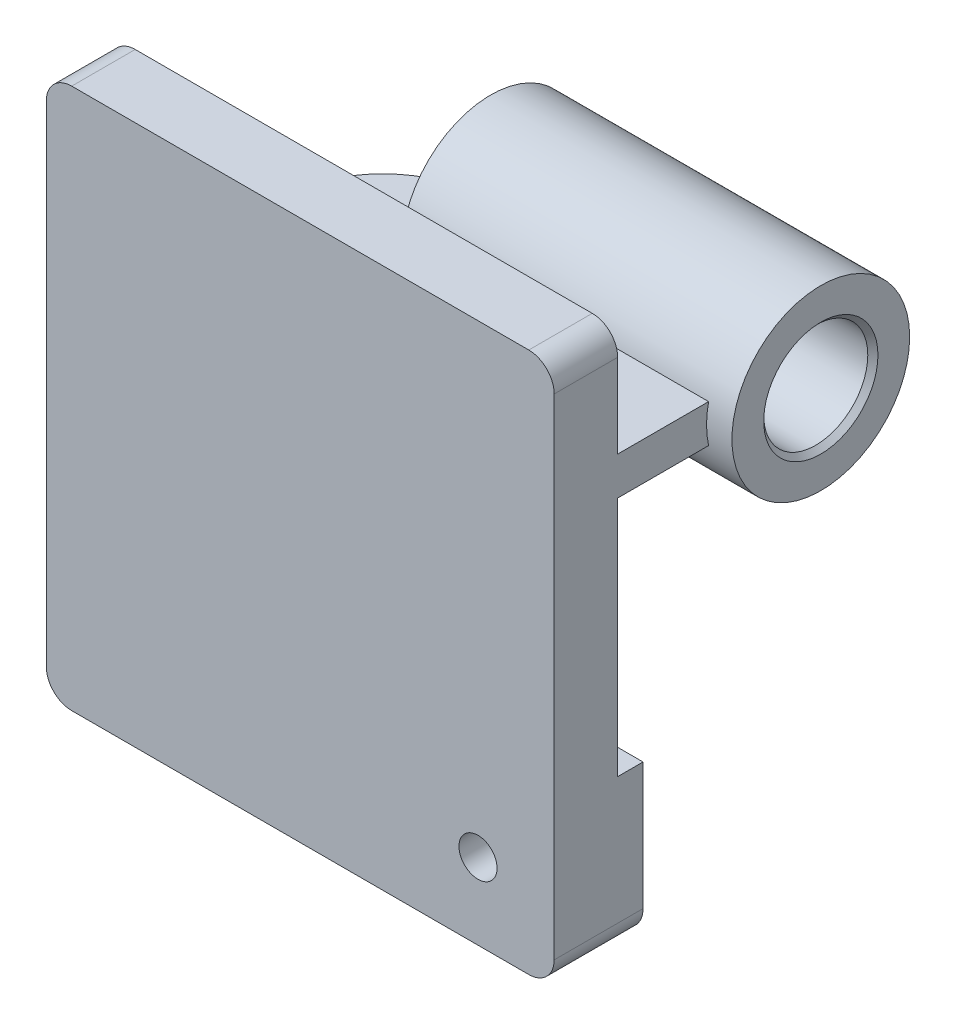
from build123d import *

# Parameters (mm, degrees)
SKETCH1_W                               = 200
SKETCH1_H                               = 213
BOSS_EXTRUDE1_DEPTH                     = 25
BOSS_EXTRUDE2_DEPTH                     = 10
BOSS_EXTRUDE3_DEPTH                     = 70
CUT_EXTRUDE1_DEPTH                      = 20
BOSS_EXTRUDE5_DEPTH                     = 10
BOSS_EXTRUDE5_DEPTH_BACK                = 120
SKETCH5_R                               = 35
BOSS_EXTRUDE6_DEPTH                     = 10
BOSS_EXTRUDE6_DEPTH_BACK                = 120
SKETCH6_R                               = 41.5
CUT_EXTRUDE2_REACH                      = 274.509
SKETCH7_R                               = 20.5
CUT_EXTRUDE3_REACH                      = 209.134
SKETCH8_R                               = 20.5
CBORE_FOR_M8_HEX_HEAD_BOLT1_D           = 15
CBORE_FOR_M8_HEX_HEAD_BOLT1_CBORE_D     = 30
CBORE_FOR_M8_HEX_HEAD_BOLT1_CBORE_DEPTH = 10
CHAMFER1_SIZE                           = 2
FILLET1_R                               = 10


with BuildPart() as part:
    # Sketch1 → Boss-Extrude1 (new body)
    with BuildSketch(Plane.XY):
        Rectangle(SKETCH1_W, SKETCH1_H)
    extrude(amount=BOSS_EXTRUDE1_DEPTH)

    # Sketch2 → Boss-Extrude2 (add)
    with BuildSketch(Plane.XY):
        with BuildLine():
            Line((100, -46.5), (55, -46.5))
            ThreePointArc((55, -46.5), (44.393398282, -50.893398282), (40, -61.5))
            Line((40, -61.5), (40, -106.5))
            Line((40, -106.5), (100, -106.5))
            Line((100, -106.5), (100, -46.5))
        make_face()
    extrude(amount=-BOSS_EXTRUDE2_DEPTH)

    # Sketch3 → Boss-Extrude3 (add)
    with BuildSketch(Plane(origin=(0, 0, 0), x_dir=(-1, 0, 0), z_dir=(0, 0, -1))):
        with BuildLine():
            Line((-100, 63.5), (-20, 63.5))
            ThreePointArc((-20, 63.5), (6.360389693, -0.139610307), (70, -26.5))
            Line((70, -26.5), (70, -106.5))
            Line((70, -106.5), (55, -106.5))
            Line((55, -106.5), (55, -41.5))
            ThreePointArc((55, -41.5), (-4.246212025, -10.746212025), (-35, 48.5))
            Line((-35, 48.5), (-100, 48.5))
            Line((-100, 48.5), (-100, 63.5))
        make_face()
    extrude(amount=BOSS_EXTRUDE3_DEPTH)

    # Sketch4 → Cut-Extrude1 (cut)
    with BuildSketch(Plane(origin=(0, 0, 0), x_dir=(-1, 0, 0), z_dir=(0, 0, -1))):
        with BuildLine():
            Line((-42.323661941, 39.5), (-91, 39.5))
            Line((-91, 39.5), (-91, -37.5))
            Line((-91, -37.5), (-55, -37.5))
            ThreePointArc((-55, -37.5), (-38.029437252, -44.529437252), (-31, -61.5))
            Line((-31, -61.5), (-31, -97.5))
            Line((-31, -97.5), (46, -97.5))
            Line((46, -97.5), (46, -48.823661941))
            ThreePointArc((46, -48.823661941), (-10.610173055, -17.110173055), (-42.323661941, 39.5))
        make_face()
    extrude(amount=-CUT_EXTRUDE1_DEPTH, mode=Mode.SUBTRACT)

    # Sketch5 → Boss-Extrude5 (add, two sides: drawn at the far end of the back side and taken through both)
    with BuildSketch(Plane(origin=(100, 0, 0), x_dir=(0, 0, -1), z_dir=(1, 0, 0)).offset(-BOSS_EXTRUDE5_DEPTH_BACK)):
        with Locations((70, 56)):
            Circle(SKETCH5_R)
    extrude(amount=BOSS_EXTRUDE5_DEPTH + BOSS_EXTRUDE5_DEPTH_BACK)

    # Sketch6 → Boss-Extrude6 (add, two sides: drawn at the far end of the back side and taken through both)
    with BuildSketch(Plane.XZ.offset(106.5).offset(-BOSS_EXTRUDE6_DEPTH_BACK)):
        with Locations(Location((-62.5, -70, 0), (0, 0, 270))):
            Circle(SKETCH6_R)
    extrude(amount=BOSS_EXTRUDE6_DEPTH + BOSS_EXTRUDE6_DEPTH_BACK)

    # Sketch7 → Cut-Extrude2 (cut, up to next)
    with BuildSketch(Plane.XZ.offset(116.5), mode=Mode.PRIVATE) as cut_extrude2_sk1:
        with Locations(Location((-62.5, -70, 0), (0, 0, 270))):
            Circle(SKETCH7_R)
    cut_extrude2_tool1 = extrude(cut_extrude2_sk1.sketch, amount=-CUT_EXTRUDE2_REACH, mode=Mode.PRIVATE) & part.part
    add(cut_extrude2_tool1.solids().sort_by_distance((-62.5, -116.5, -70))[0], mode=Mode.SUBTRACT)

    # Sketch8 → Cut-Extrude3 (cut, up to next)
    with BuildSketch(Plane.ZY.offset(20), mode=Mode.PRIVATE) as cut_extrude3_sk1:
        with Locations((-70, 56)):
            Circle(SKETCH8_R)
    cut_extrude3_tool1 = extrude(cut_extrude3_sk1.sketch, amount=-CUT_EXTRUDE3_REACH, mode=Mode.PRIVATE) & part.part
    add(cut_extrude3_tool1.solids().sort_by_distance((-20, 56, -70))[0], mode=Mode.SUBTRACT)

    # CBORE for M8 Hex Head Bolt1 (through all)
    with Locations(Plane(origin=(70, -76.5, -10), x_dir=(-1, 0, 0), z_dir=(0, 0, -1))):
        with Locations((0, 0)):
            CounterBoreHole(CBORE_FOR_M8_HEX_HEAD_BOLT1_D / 2, CBORE_FOR_M8_HEX_HEAD_BOLT1_CBORE_D / 2, CBORE_FOR_M8_HEX_HEAD_BOLT1_CBORE_DEPTH)

    # Chamfer1
    chamfer1_edges = [part.edges().sort_by_distance(p)[0] for p in [
        (-62.5, -116.5, -49.5),
        (-62.5, 13.5, -49.5),
        (110, 56, -90.5),
        (-20, 56, -90.5),
    ]]
    chamfer(chamfer1_edges, length=CHAMFER1_SIZE)

    # Fillet1
    fillet1_edges = [part.edges().sort_by_distance(p)[0] for p in [
        (42.323661941, 39.5, 10),
        (-46, -48.823661941, 10),
        (-46, -97.5, 10),
        (31, -97.5, 10),
        (91, -37.5, 10),
        (91, 39.5, 10),
        (100, -106.5, 7.5),
        (-100, -106.5, 12.5),
        (-100, 106.5, 12.5),
        (100, 106.5, 12.5),
    ]]
    fillet(fillet1_edges, radius=FILLET1_R)


solid = part.part
